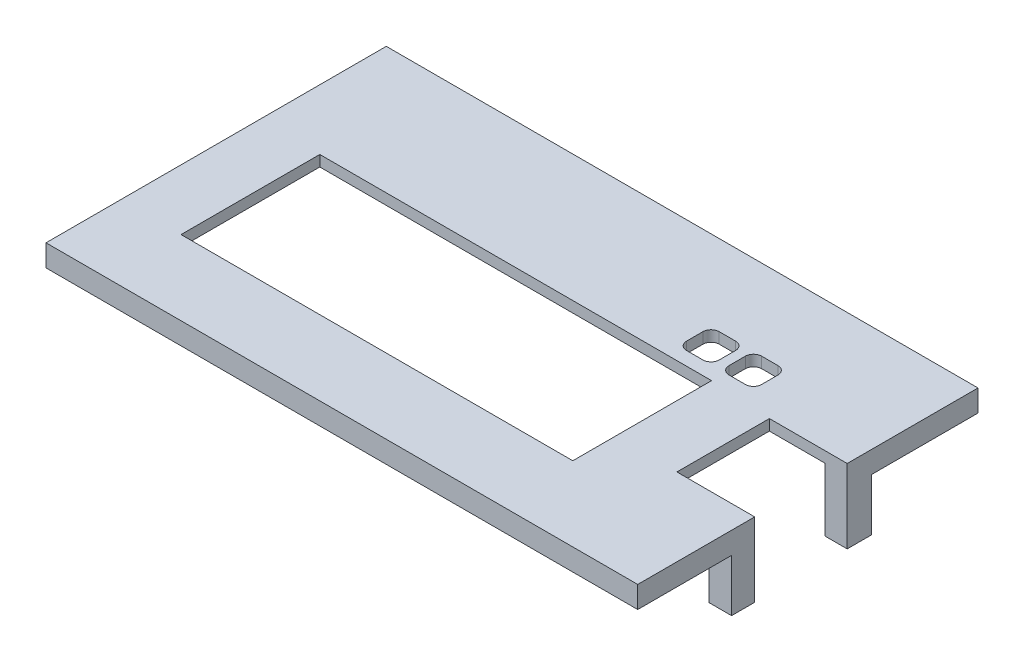
from build123d import *

# Parameters (mm, degrees)
LID_W               = 108.75
LID_H               = 62.54
EXTRUDE_1_DEPTH     = 2
CUT_EXTRUDE_1_REACH = 95.36
SKETCH_8_W          = 72
SKETCH_8_H          = 25.5
CUT_EXTRUDE_3_REACH = 95.36
SKETCH_15_W         = 6
SKETCH_15_H         = 6
FILLET_1_R          = 1.5
SKETCH_16_W         = 108.75
SKETCH_16_H         = 62.54
SKETCH_16_W_2       = 104.75
SKETCH_16_H_2       = 58.54
EXTRUDE_2_DEPTH     = 2
SKETCH_17_W         = 14.3
SKETCH_17_H         = 17
CUT_EXTRUDE_4_DEPTH = 4
SKETCH_18_W         = 4.1
SKETCH_18_H         = 4.5
SKETCH_18_W_2       = 4.169367978
SKETCH_18_H_2       = 4.25
EXTRUDE_3_DEPTH     = 11.6


with BuildPart() as part:
    # lid → ﾎﾞｽ - 押し出し1 (new body)
    with BuildSketch(Plane(origin=(0, 0, 0), x_dir=(1, 0, 0), z_dir=(0, 1, 0))):
        with Locations((18.405, 27.17)):
            Rectangle(LID_W, LID_H)
    extrude(amount=EXTRUDE_1_DEPTH)

    # ｽｹｯﾁ8 → ｶｯﾄ - 押し出し1 (cut, up to next)
    with BuildSketch(Plane(origin=(0, 2, 0), x_dir=(1, 0, 0), z_dir=(0, 1, 0)), mode=Mode.PRIVATE) as cut_extrude_1_sk1:
        with Locations((11.13, 22.37)):
            Rectangle(SKETCH_8_W, SKETCH_8_H)
    cut_extrude_1_tool1 = extrude(cut_extrude_1_sk1.sketch, amount=-CUT_EXTRUDE_1_REACH, mode=Mode.PRIVATE) & part.part
    add(cut_extrude_1_tool1.solids().sort_by_distance((11.13, 2, -22.37))[0], mode=Mode.SUBTRACT)

    # ｽｹｯﾁ15 → ｶｯﾄ - 押し出し3 (cut, up to next)
    with BuildSketch(Plane(origin=(0, 2, 0), x_dir=(1, 0, 0), z_dir=(0, 1, 0)), mode=Mode.PRIVATE) as cut_extrude_3_sk1:
        with Locations((41.54, 40.62)):
            Rectangle(SKETCH_15_W, SKETCH_15_H)
    cut_extrude_3_tool1 = extrude(cut_extrude_3_sk1.sketch, amount=-CUT_EXTRUDE_3_REACH, mode=Mode.PRIVATE) & part.part
    # ｽｹｯﾁ15 → ｶｯﾄ - 押し出し3 (cut, up to next)
    with BuildSketch(Plane(origin=(0, 2, 0), x_dir=(1, 0, 0), z_dir=(0, 1, 0)), mode=Mode.PRIVATE) as cut_extrude_3_sk2:
        with Locations((49.34, 40.62)):
            Rectangle(SKETCH_15_W, SKETCH_15_H)
    cut_extrude_3_tool2 = extrude(cut_extrude_3_sk2.sketch, amount=-CUT_EXTRUDE_3_REACH, mode=Mode.PRIVATE) & part.part
    add(cut_extrude_3_tool1.solids().sort_by_distance((41.54, 2, -40.62))[0], mode=Mode.SUBTRACT)
    add(cut_extrude_3_tool2.solids().sort_by_distance((49.34, 2, -40.62))[0], mode=Mode.SUBTRACT)

    # ﾌｨﾚｯﾄ1
    fillet_1_edges = [part.edges().sort_by_distance(p)[0] for p in [
        (38.54, 1, -37.62),
        (38.54, 1, -43.62),
        (44.54, 1, -43.62),
        (44.54, 1, -37.62),
        (46.34, 1, -37.62),
        (46.34, 1, -43.62),
        (52.34, 1, -43.62),
        (52.34, 1, -37.62),
    ]]
    fillet(fillet_1_edges, radius=FILLET_1_R)

    # ｽｹｯﾁ16 → ﾎﾞｽ - 押し出し2 (add)
    with BuildSketch(Plane.XZ):
        with Locations((18.405, -27.17)):
            Rectangle(SKETCH_16_W, SKETCH_16_H)
        with Locations((18.405, -27.17)):
            Rectangle(SKETCH_16_W_2, SKETCH_16_H_2, mode=Mode.SUBTRACT)
    extrude(amount=EXTRUDE_2_DEPTH)

    # ｽｹｯﾁ17 → ｶｯﾄ - 押し出し4 (cut)
    with BuildSketch(Plane(origin=(0, 2, 0), x_dir=(1, 0, 0), z_dir=(0, 1, 0))):
        with Locations((65.63, 25.9)):
            Rectangle(SKETCH_17_W, SKETCH_17_H)
    extrude(amount=-CUT_EXTRUDE_4_DEPTH, mode=Mode.SUBTRACT)

    # ｽｹｯﾁ18 → ﾎﾞｽ - 押し出し3 (add)
    with BuildSketch(Plane.XZ):
        with Locations((70.73, -36.65)):
            Rectangle(SKETCH_18_W, SKETCH_18_H)
        with Locations((70.695316011, -15.275)):
            Rectangle(SKETCH_18_W_2, SKETCH_18_H_2)
    extrude(amount=EXTRUDE_3_DEPTH)


solid = part.part
